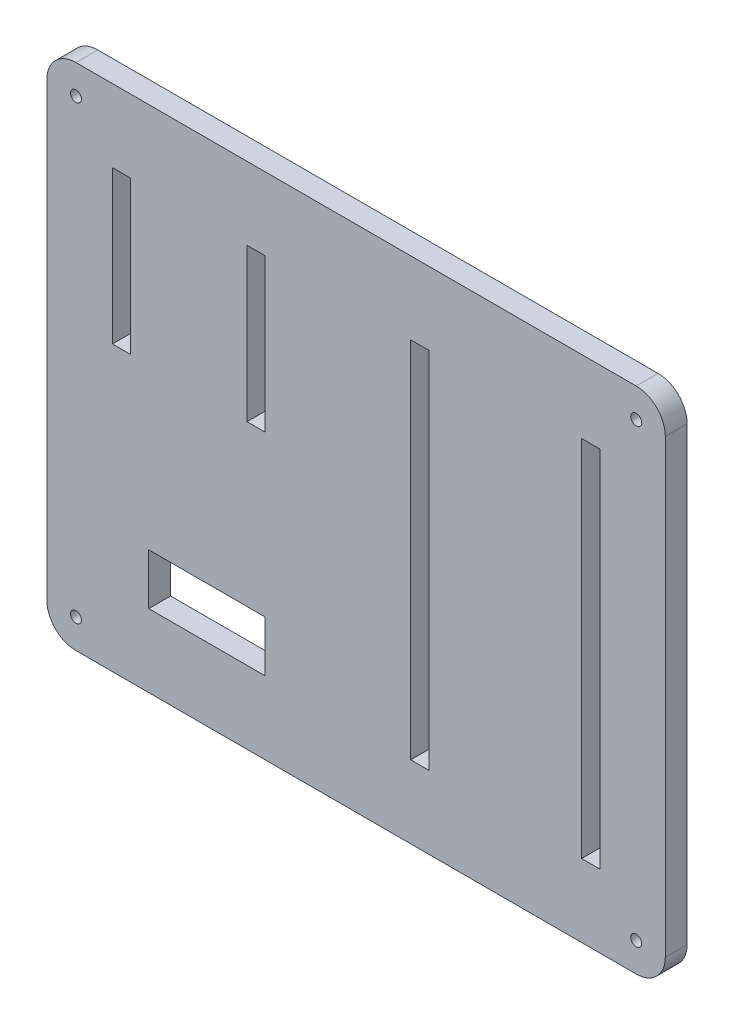
from build123d import *

# Parameters (mm, degrees)
SKETCH1_W           = 85
SKETCH1_H           = 70
BOSS_EXTRUDE1_DEPTH = 3
SKETCH2_W           = 2.5
SKETCH2_H           = 50
SKETCH2_H_2         = 21
SKETCH2_W_2         = 16
SKETCH2_H_3         = 7
CUT_EXTRUDE1_DEPTH  = 56.138462075
FILLET1_R           = 4
SKETCH4_R           = 0.75
CUT_EXTRUDE3_DEPTH  = 10


with BuildPart() as part:
    # Sketch1 → Boss-Extrude1 (new body)
    with BuildSketch(Plane.XY):
        Rectangle(SKETCH1_W, SKETCH1_H)
    extrude(amount=BOSS_EXTRUDE1_DEPTH)

    # Sketch2 → Cut-Extrude1 (cut, through all)
    with BuildSketch(Plane(origin=(0, 0, 0), x_dir=(-1, 0, 0), z_dir=(0, 0, -1))):
        with Locations((-32.25, 0)):
            Rectangle(SKETCH2_W, SKETCH2_H)
        with Locations((-8.75, 0)):
            Rectangle(SKETCH2_W, SKETCH2_H)
        with Locations((13.75, 14.5)):
            Rectangle(SKETCH2_W, SKETCH2_H_2)
        with Locations((32.25, 14.5)):
            Rectangle(SKETCH2_W, SKETCH2_H_2)
        with Locations((20.5, -21.5)):
            Rectangle(SKETCH2_W_2, SKETCH2_H_3)
    extrude(amount=-CUT_EXTRUDE1_DEPTH, mode=Mode.SUBTRACT)

    # Fillet1
    fillet1_edges = [part.edges().sort_by_distance(p)[0] for p in [
        (42.5, -35, 1.5),
        (-42.5, -35, 1.5),
        (-42.5, 35, 1.5),
        (42.5, 35, 1.5),
    ]]
    fillet(fillet1_edges, radius=FILLET1_R)

    # Sketch4 → Cut-Extrude3 (cut)
    with BuildSketch(Plane(origin=(0, 0, 0), x_dir=(-1, 0, 0), z_dir=(0, 0, -1))):
        with Locations((-38.5, 31)):
            Circle(SKETCH4_R)
        with Locations(Location((38.5, 31, 0), (0, 0, 180))):
            Circle(SKETCH4_R)
        with Locations((38.5, -31)):
            Circle(SKETCH4_R)
        with Locations(Location((-38.5, -31, 0), (0, 0, 180))):
            Circle(SKETCH4_R)
    extrude(amount=-CUT_EXTRUDE3_DEPTH, mode=Mode.SUBTRACT)


solid = part.part
